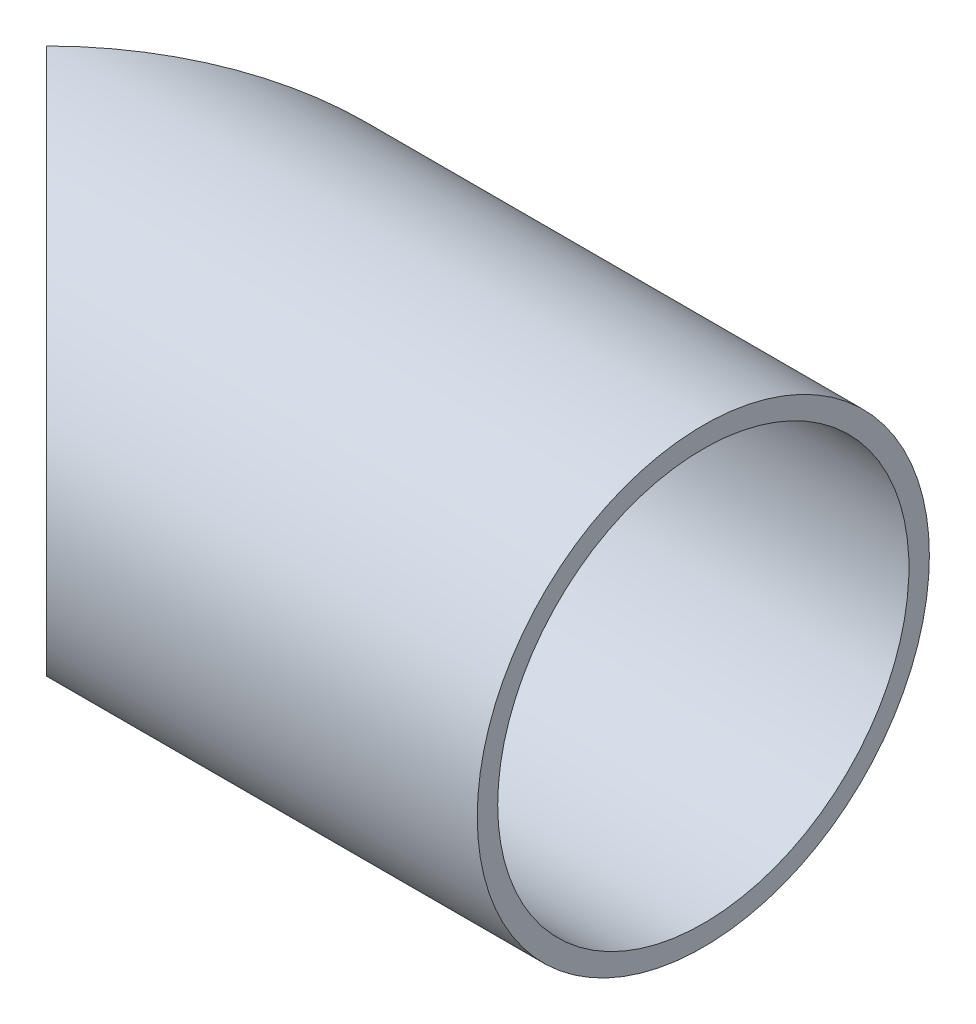
from build123d import *

# Parameters (mm, degrees)
CUT_EXTRUDE1_DEPTH      = 25.909837414
CUT_EXTRUDE1_DEPTH_BACK = 25.909837414
SKETCH2_R               = 0.9
CUT_EXTRUDE2_DEPTH      = 25.909837579


with BuildPart() as part:
    # Sketch1 → Revolve1 (revolve)
    with BuildSketch(Plane.XY):
        with BuildLine():
            Line((20, 10.5), (-10.5, 10.5))
            ThreePointArc((-10.5, 10.5), (-8.266728857, 10.259751459), (-6.135655834, 9.55))
            Line((-6.135655834, 9.55), (20, 9.55))
            Line((20, 9.55), (20, 10.5))
        make_face()
    revolve(axis=Axis((0, 0, 0), (1, 0, 0)))

    # Sketch1<3> → Cut-Extrude1 (cut, two sides: drawn at the far end of the back side and taken through both)
    with BuildSketch(Plane.XY.offset(-CUT_EXTRUDE1_DEPTH_BACK)):
        with BuildLine():
            ThreePointArc((-10.5, -10.5), (0, 0), (-10.5, 10.5))
            Line((-10.5, 10.5), (-10.5, -10.5))
        make_face()
    extrude(amount=CUT_EXTRUDE1_DEPTH + CUT_EXTRUDE1_DEPTH_BACK, mode=Mode.SUBTRACT)

    # Sketch2 → Cut-Extrude2 (cut, through all)
    with BuildSketch(Plane.XY):
        with Locations((2, 0)):
            Circle(SKETCH2_R)
    extrude(amount=-CUT_EXTRUDE2_DEPTH, mode=Mode.SUBTRACT)


solid = part.part
